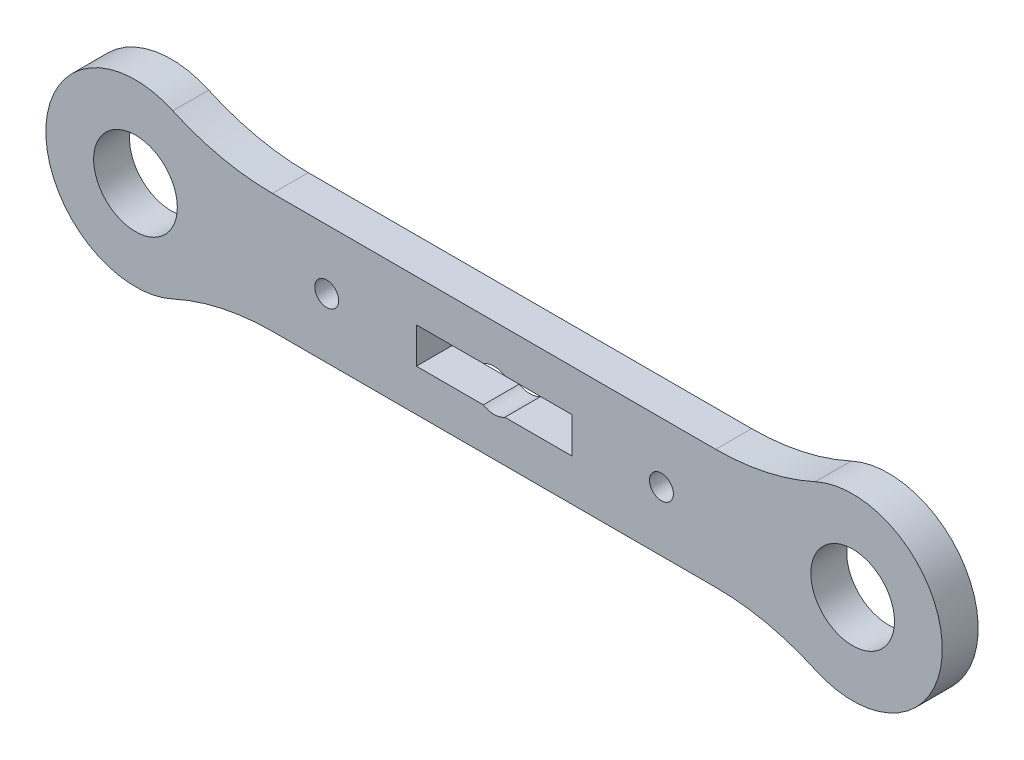
from build123d import *

# Parameters (mm, degrees)
ESBO_O1_R                = 1
ESBO_O1_R_2              = 3.5
RESSALTO_EXTRUS_O1_DEPTH = 3
FILETE1_R                = 20


with BuildPart() as part:
    # Esboço1 → Ressalto-extrusão1 (new body)
    with BuildSketch(Plane.XY):
        with BuildLine():
            Line((5.590169944, -5), (54.409830056, -5))
            ThreePointArc((54.409830056, -5), (67.5, 0), (54.409830056, 5))
            Line((54.409830056, 5), (5.590169944, 5))
            ThreePointArc((5.590169944, 5), (-7.5, 0), (5.590169944, -5))
        make_face()
        with Locations((44, 0)):
            Circle(ESBO_O1_R, mode=Mode.SUBTRACT)
        with Locations((16, 0)):
            Circle(ESBO_O1_R, mode=Mode.SUBTRACT)
        Circle(ESBO_O1_R_2, mode=Mode.SUBTRACT)
        with Locations((60, 0)):
            Circle(ESBO_O1_R_2, mode=Mode.SUBTRACT)
        with BuildLine():
            Line((30.901387819, 1.5), (36.5, 1.5))
            Line((36.5, 1.5), (36.5, -1.5))
            Line((36.5, -1.5), (30.901387819, -1.5))
            ThreePointArc((30.901387819, -1.5), (30, -1.75), (29.098612181, -1.5))
            Line((29.098612181, -1.5), (23.5, -1.5))
            Line((23.5, -1.5), (23.5, 1.5))
            Line((23.5, 1.5), (29.098612181, 1.5))
            ThreePointArc((29.098612181, 1.5), (30, 1.75), (30.901387819, 1.5))
        make_face(mode=Mode.SUBTRACT)
    extrude(amount=RESSALTO_EXTRUS_O1_DEPTH)

    # Filete1
    filete1_edges = [part.edges().sort_by_distance(p)[0] for p in [
        (54.409830056, -5, 1.5),
        (5.590169944, -5, 1.5),
        (5.590169944, 5, 1.5),
        (54.409830056, 5, 1.5),
    ]]
    fillet(filete1_edges, radius=FILETE1_R)


solid = part.part
